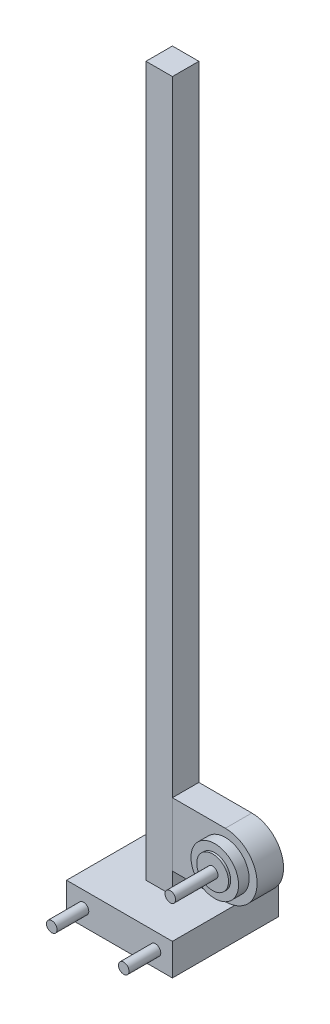
from build123d import *

# Parameters (mm, degrees)
SKETCH_1_W      = 25
SKETCH_1_H      = 25
EXTRUDE_1_DEPTH = 700
EXTRUDE_2_DEPTH = 25
SKETCH_3_R      = 22.5
EXTRUDE_3_DEPTH = 10
SKETCH_4_R      = 15
EXTRUDE_4_DEPTH = 2
SKETCH_6_R      = 5
EXTRUDE_5_DEPTH = 40
SKETCH_7_W      = 100
SKETCH_7_H      = 100
EXTRUDE_6_DEPTH = 30
SKETCH_9_R      = 5
EXTRUDE_7_DEPTH = 30


with BuildPart() as part:
    # 草图1 → 凸台-拉伸1 (new body)
    with BuildSketch(Plane(origin=(0, 0, 0), x_dir=(1, 0, 0), z_dir=(0, 1, 0))):
        with Locations((12.5, 12.5)):
            Rectangle(SKETCH_1_W, SKETCH_1_H)
    extrude(amount=EXTRUDE_1_DEPTH)

    # 草图7 → 凸台-拉伸6 (add)
    with BuildSketch(Plane(origin=(0, 0, 0), x_dir=(1, 0, 0), z_dir=(0, 1, 0))):
        with Locations((12.5, 12.5)):
            Rectangle(SKETCH_7_W, SKETCH_7_H)
    extrude(amount=EXTRUDE_6_DEPTH)

    # 草图9 → 凸台-拉伸7 (add)
    with BuildSketch(Plane.XY.offset(37.5)):
        with Locations(Location((-21.5, 15, 0), (0, 0, 180))):
            Circle(SKETCH_9_R)
        with Locations(Location((46.5, 15, 0), (0, 0, 180))):
            Circle(SKETCH_9_R)
    extrude(amount=EXTRUDE_7_DEPTH)


with BuildPart() as body_2:
    # 草图2 → 凸台-拉伸2 (new body)
    with BuildSketch(Plane.XY):
        with BuildLine():
            Line((75, 110), (25, 110))
            Line((25, 110), (25, 50))
            Line((25, 50), (75, 50))
            ThreePointArc((75, 50), (105, 80), (75, 110))
        make_face()
    extrude(amount=-EXTRUDE_2_DEPTH)


with BuildPart() as body_3:
    # 草图3 → 凸台-拉伸3 (new body)
    with BuildSketch(Plane.XY):
        with Locations((75, 80)):
            Circle(SKETCH_3_R)
    extrude(amount=EXTRUDE_3_DEPTH)


with BuildPart() as body_4:
    # 草图4 → 凸台-拉伸4 (new body)
    with BuildSketch(Plane.XY.offset(10)):
        with Locations((75, 80)):
            Circle(SKETCH_4_R)
    extrude(amount=EXTRUDE_4_DEPTH)


with BuildPart() as body_5:
    # 草图6 → 凸台-拉伸5 (new body)
    with BuildSketch(Plane.XY.offset(12)):
        with Locations((75, 80)):
            Circle(SKETCH_6_R)
    extrude(amount=EXTRUDE_5_DEPTH)


solid = Compound([part.part, body_2.part, body_3.part, body_4.part, body_5.part])
